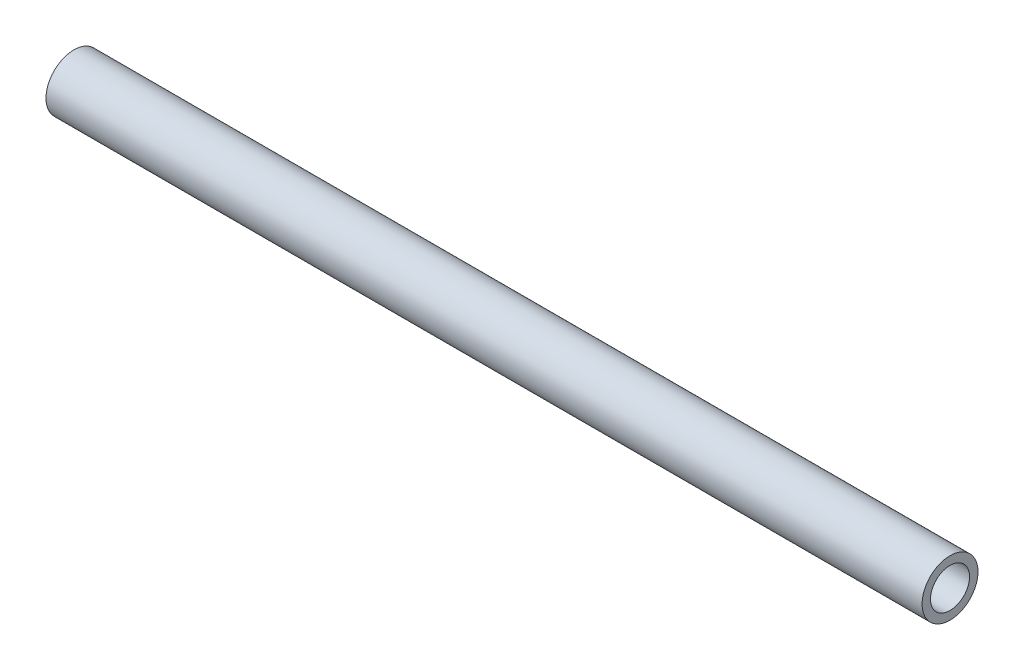
from build123d import *

# Parameters (mm, degrees)
SKETCH2_R           = 10.541
SKETCH2_R_2         = 7.366
BOSS_EXTRUDE1_DEPTH = 330.2


with BuildPart() as part:
    # Sketch2 → Boss-Extrude1 (new body)
    with BuildSketch(Plane(origin=(0, 0, 0), x_dir=(0, 0, -1), z_dir=(1, 0, 0))):
        Circle(SKETCH2_R)
        Circle(SKETCH2_R_2, mode=Mode.SUBTRACT)
    extrude(amount=BOSS_EXTRUDE1_DEPTH)


solid = part.part
